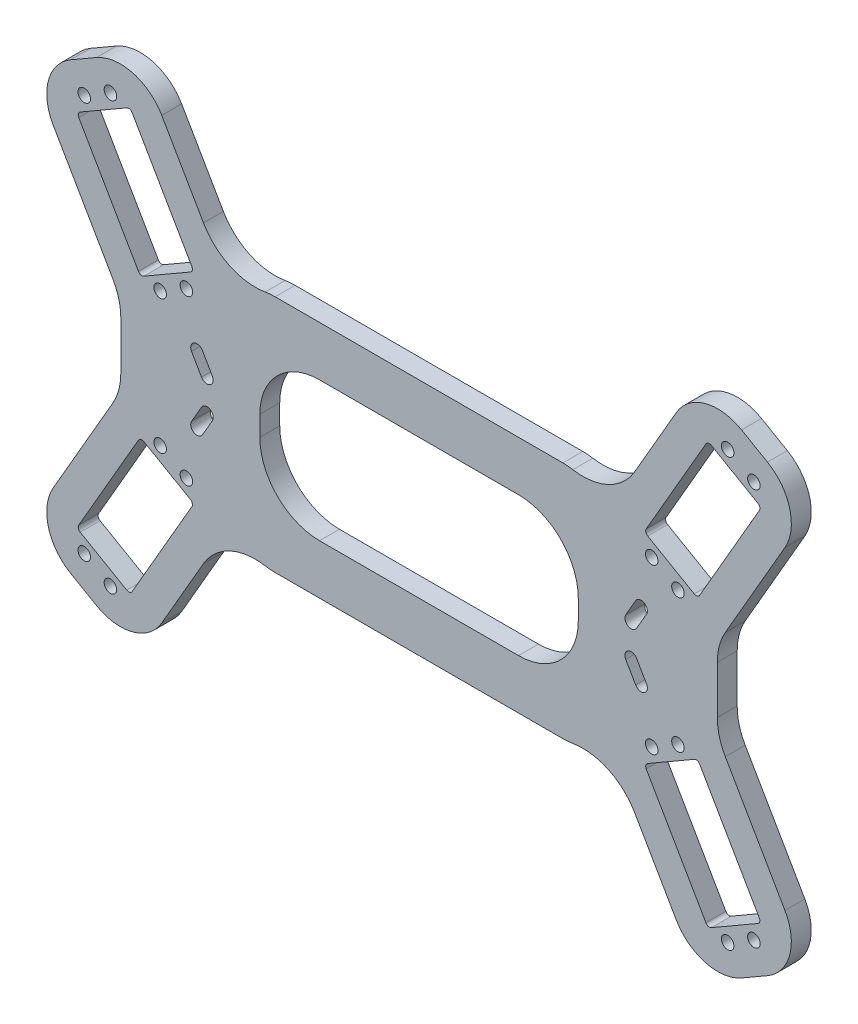
from build123d import *

# Parameters (mm, degrees)
ESQUISSE1_W             = 101.6
ESQUISSE1_H             = 44.45
BOSS_EXTRU_1_DEPTH      = 6.35
ESQUISSE2_R             = 2
ENL_V_MAT_EXTRU_1_DEPTH = 6.35
CONG_1_R                = 19.05
CONG_2_R                = 19.05
CONG_3_R                = 19.05
CONG_4_R                = 1.27
CONG_5_R                = 15.24


with BuildPart() as part:
    # Esquisse1 → Boss.-Extru.1 (new body)
    with BuildSketch(Plane.XY):
        Polygon((50.8, 38.1), (-50.8, 38.1), (-60.513471824, 32.748090949), (-89.723471824, 83.341295038), (-124.368818102, 63.338795038), (-95.158818102, 12.745590949), (-95.158818102, -12.745590949), (-124.368818102, -63.338795038), (-89.723471824, -83.341295038), (-60.513471824, -32.748090949), (-50.8, -38.1), (50.8, -38.1), (60.513471824, -32.748090949), (89.723471824, -83.341295038), (124.368818102, -63.338795038), (95.158818102, -12.745590949), (95.158818102, 12.745590949), (124.368818102, 63.338795038), (89.723471824, 83.341295038), (60.513471824, 32.748090949), align=None)
        Polygon((-109.22, -57.42027241), (-88.9, -22.225), (-71.852289927, -32.0675), (-92.172289927, -67.26277241), align=None, mode=Mode.SUBTRACT)
        Polygon((71.852289927, -32.0675), (88.9, -22.225), (109.22, -57.42027241), (92.172289927, -67.26277241), align=None, mode=Mode.SUBTRACT)
        Rectangle(ESQUISSE1_W, ESQUISSE1_H, mode=Mode.SUBTRACT)
        Polygon((71.852289927, 32.0675), (92.172289927, 67.26277241), (109.22, 57.42027241), (88.9, 22.225), align=None, mode=Mode.SUBTRACT)
        Polygon((-109.22, 57.42027241), (-92.172289927, 67.26277241), (-71.852289927, 32.0675), (-88.9, 22.225), align=None, mode=Mode.SUBTRACT)
    extrude(amount=BOSS_EXTRU_1_DEPTH)

    # Esquisse2 → Enlèv. mat.-Extru.1 (cut)
    with BuildSketch(Plane.XY.offset(6.35)):
        with Locations((-82.603083562, 21.351420798)):
            Circle(ESQUISSE2_R)
        with Locations((-74.244206365, 26.177420798)):
            Circle(ESQUISSE2_R)
        with Locations(Location((-74.244206365, -26.177420798, 0), (0, 0, 180))):
            Circle(ESQUISSE2_R)
        with Locations(Location((-82.603083562, -21.351420798, 0), (0, 0, 180))):
            Circle(ESQUISSE2_R)
        with Locations((82.603083562, -21.351420798)):
            Circle(ESQUISSE2_R)
        with Locations((74.244206365, -26.177420798)):
            Circle(ESQUISSE2_R)
        with Locations(Location((74.244206365, 26.177420798, 0), (0, 0, 180))):
            Circle(ESQUISSE2_R)
        with Locations(Location((82.603083562, 21.351420798, 0), (0, 0, 180))):
            Circle(ESQUISSE2_R)
        with Locations(Location((-98.469206365, 68.136351612, 0), (0, 0, 180))):
            Circle(ESQUISSE2_R)
        with Locations(Location((-106.828083562, 63.310351612, 0), (0, 0, 180))):
            Circle(ESQUISSE2_R)
        with Locations((106.828083562, 63.310351612)):
            Circle(ESQUISSE2_R)
        with Locations((98.469206365, 68.136351612)):
            Circle(ESQUISSE2_R)
        with Locations(Location((98.469206365, -68.136351612, 0), (0, 0, 180))):
            Circle(ESQUISSE2_R)
        with Locations(Location((106.828083562, -63.310351612, 0), (0, 0, 180))):
            Circle(ESQUISSE2_R)
        with Locations((-106.828083562, -63.310351612)):
            Circle(ESQUISSE2_R)
        with Locations((-98.469206365, -68.136351612)):
            Circle(ESQUISSE2_R)
        with BuildLine():
            Line((-69.119094156, 11.648466058), (-65.944094156, 6.149204744))
            ThreePointArc((-65.944094156, 6.149204744), (-66.676144963, 3.417153936), (-69.408195771, 4.149204744))
            Line((-69.408195771, 4.149204744), (-72.583195771, 9.648466058))
            ThreePointArc((-72.583195771, 9.648466058), (-71.851144963, 12.380516865), (-69.119094156, 11.648466058))
        make_face()
        with BuildLine():
            Line((-69.119094156, -11.648466058), (-65.944094156, -6.149204744))
            ThreePointArc((-65.944094156, -6.149204744), (-66.676144963, -3.417153936), (-69.408195771, -4.149204744))
            Line((-69.408195771, -4.149204744), (-72.583195771, -9.648466058))
            ThreePointArc((-72.583195771, -9.648466058), (-71.851144963, -12.380516865), (-69.119094156, -11.648466058))
        make_face()
        with BuildLine():
            Line((69.119094156, -11.648466058), (65.944094156, -6.149204744))
            ThreePointArc((65.944094156, -6.149204744), (66.676144963, -3.417153936), (69.408195771, -4.149204744))
            Line((69.408195771, -4.149204744), (72.583195771, -9.648466058))
            ThreePointArc((72.583195771, -9.648466058), (71.851144963, -12.380516865), (69.119094156, -11.648466058))
        make_face()
        with BuildLine():
            Line((69.119094156, 11.648466058), (65.944094156, 6.149204744))
            ThreePointArc((65.944094156, 6.149204744), (66.676144963, 3.417153936), (69.408195771, 4.149204744))
            Line((69.408195771, 4.149204744), (72.583195771, 9.648466058))
            ThreePointArc((72.583195771, 9.648466058), (71.851144963, 12.380516865), (69.119094156, 11.648466058))
        make_face()
    extrude(amount=-ENL_V_MAT_EXTRU_1_DEPTH, mode=Mode.SUBTRACT)

    # Congé1
    cong_1_edges = [part.edges().sort_by_distance(p)[0] for p in [
        (50.8, -22.225, 3.175),
        (50.8, 22.225, 3.175),
        (-50.8, 22.225, 3.175),
        (-50.8, -22.225, 3.175),
    ]]
    fillet(cong_1_edges, radius=CONG_1_R)

    # Congé2
    cong_2_edges = [part.edges().sort_by_distance(p)[0] for p in [
        (-95.158818102, 12.745590949, 3.175),
        (-50.8, 38.1, 3.175),
        (50.8, 38.1, 3.175),
        (95.158818102, 12.745590949, 3.175),
        (95.158818102, -12.745590949, 3.175),
        (50.8, -38.1, 3.175),
        (-50.8, -38.1, 3.175),
        (-95.158818102, -12.745590949, 3.175),
    ]]
    fillet(cong_2_edges, radius=CONG_2_R)

    # Congé3
    cong_3_edges = [part.edges().sort_by_distance(p)[0] for p in [
        (60.513471824, 32.748090949, 3.175),
        (-60.513471824, 32.748090949, 3.175),
        (-60.513471824, -32.748090949, 3.175),
        (60.513471824, -32.748090949, 3.175),
    ]]
    fillet(cong_3_edges, radius=CONG_3_R)

    # Congé4
    cong_4_edges = [part.edges().sort_by_distance(p)[0] for p in [
        (109.22, 57.42027241, 3.175),
        (92.172289927, 67.26277241, 3.175),
        (71.852289927, 32.0675, 3.175),
        (88.9, 22.225, 3.175),
        (71.852289927, -32.0675, 3.175),
        (92.172289927, -67.26277241, 3.175),
        (109.22, -57.42027241, 3.175),
        (88.9, -22.225, 3.175),
        (-71.852289927, 32.0675, 3.175),
        (-92.172289927, 67.26277241, 3.175),
        (-109.22, 57.42027241, 3.175),
        (-88.9, 22.225, 3.175),
        (-109.22, -57.42027241, 3.175),
        (-92.172289927, -67.26277241, 3.175),
        (-71.852289927, -32.0675, 3.175),
        (-88.9, -22.225, 3.175),
    ]]
    fillet(cong_4_edges, radius=CONG_4_R)

    # Congé5
    cong_5_edges = [part.edges().sort_by_distance(p)[0] for p in [
        (-124.368818102, 63.338795038, 3.175),
        (-89.723471824, 83.341295038, 3.175),
        (89.723471824, 83.341295038, 3.175),
        (124.368818102, 63.338795038, 3.175),
        (124.368818102, -63.338795038, 3.175),
        (89.723471824, -83.341295038, 3.175),
        (-89.723471824, -83.341295038, 3.175),
        (-124.368818102, -63.338795038, 3.175),
    ]]
    fillet(cong_5_edges, radius=CONG_5_R)


solid = part.part
